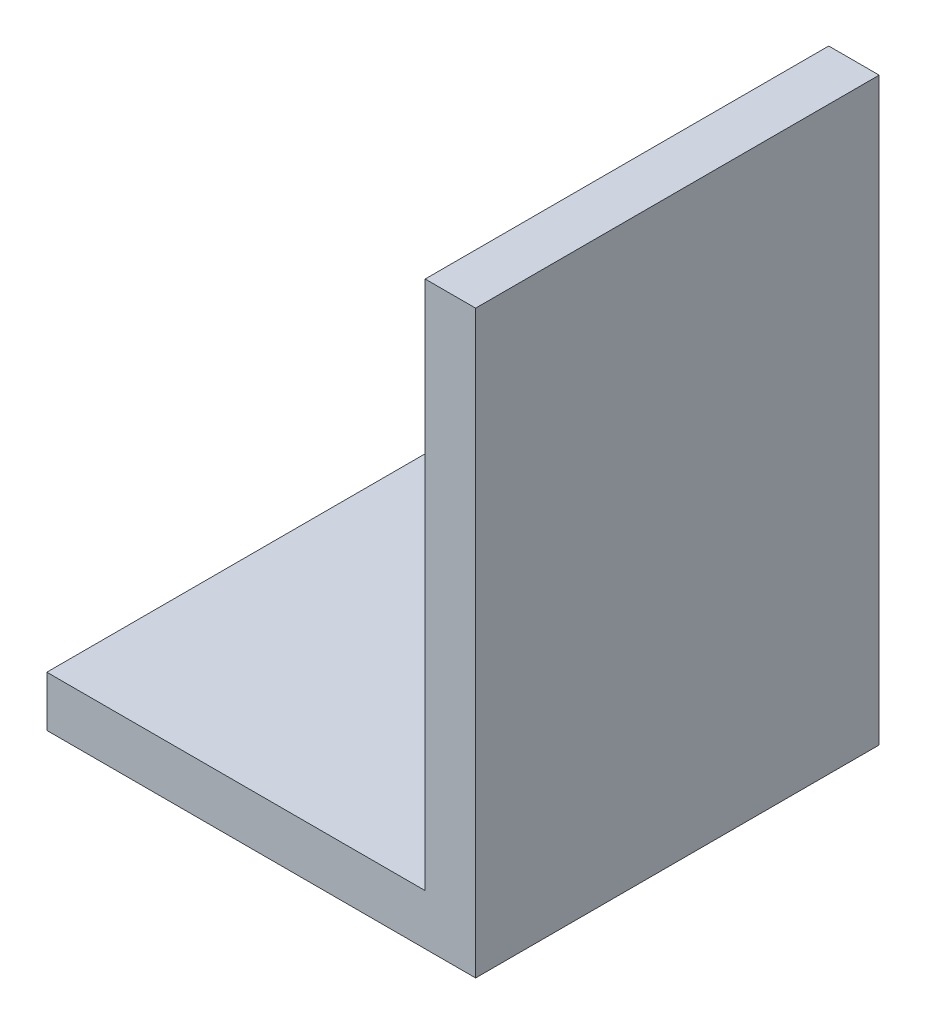
from build123d import *

# Parameters (mm, degrees)
OUTRIGGER_SECTION_DEPTH = 16


with BuildPart() as part:
    # Outrigger section profile → Outrigger section (new body)
    with BuildSketch(Plane.XY):
        Polygon((126, 7), (143, 7), (143, 30), (141, 30), (141, 9), (126, 9), align=None)
    extrude(amount=OUTRIGGER_SECTION_DEPTH)


solid = part.part
